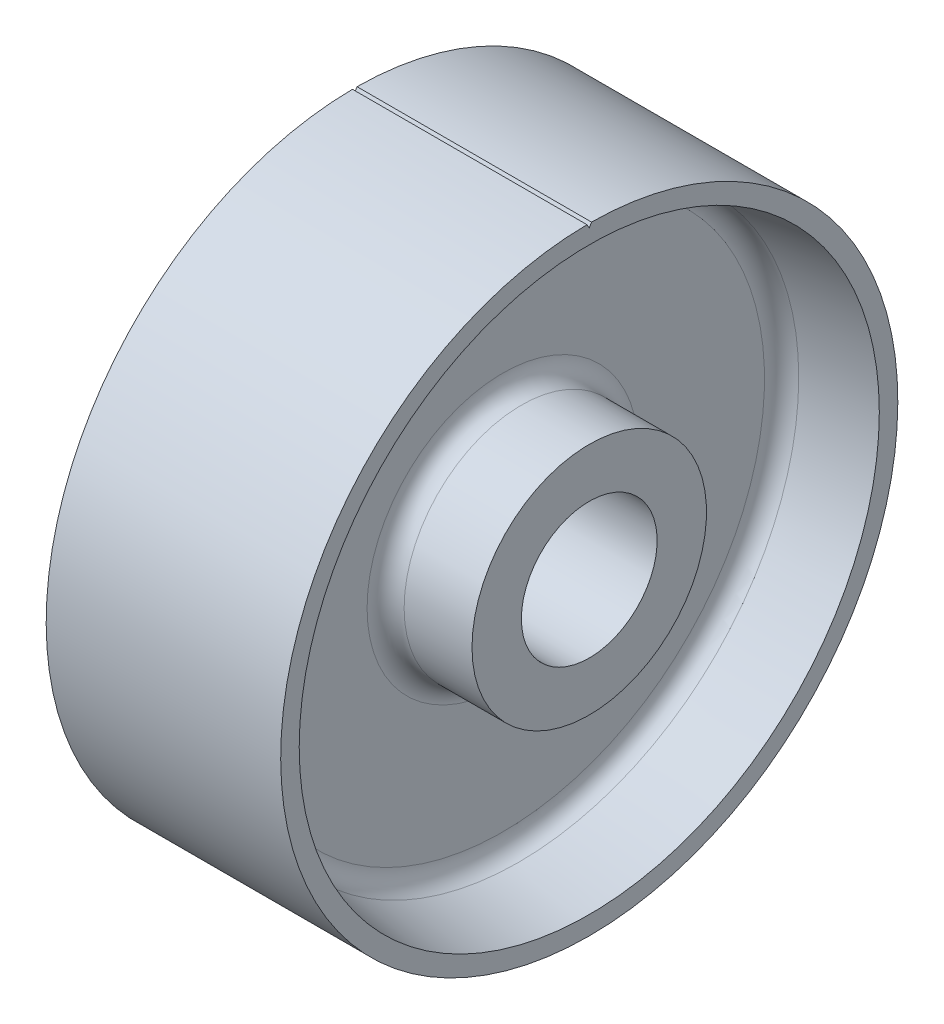
from build123d import *

# Parameters (mm, degrees)
FILLET_1_R          = 3
CUT_EXTRUDE_1_DEPTH = 81.274528962


with BuildPart() as part:
    # 草圖1 → 旋轉1 (revolve)
    with BuildSketch(Plane.XY, mode=Mode.PRIVATE) as revolve_1_sk:
        Polygon((-19, 11), (19, 11), (19, 19), (5, 19), (5, 45), (19, 47), (19, 50), (-19, 50), (-19, 47), (-5, 45), (-5, 19), (-19, 19), align=None)
    revolve(revolve_1_sk.sketch.rotate(Axis((-30.665853659, 0, 0), (1, 0, 0)), 90), axis=Axis((-30.665853659, 0, 0), (1, 0, 0)))

    # 圓角1
    fillet_1_edges = [part.edges().sort_by_distance(p)[0] for p in [
        (-5, 0, -19),
        (5, 0, -19),
        (5, 0, -45),
        (-5, 0, -45),
    ]]
    fillet(fillet_1_edges, radius=FILLET_1_R)

    # 草圖2 → 伸長1 (cut, through all)
    with BuildSketch(Plane(origin=(19, 0, 0), x_dir=(0, 0, -1), z_dir=(1, 0, 0))):
        Polygon((-0.913442032, 50.94560231), (0.913442032, 50.94560231), (0, 49.363474301), align=None)
    extrude(amount=-CUT_EXTRUDE_1_DEPTH, mode=Mode.SUBTRACT)


solid = part.part
